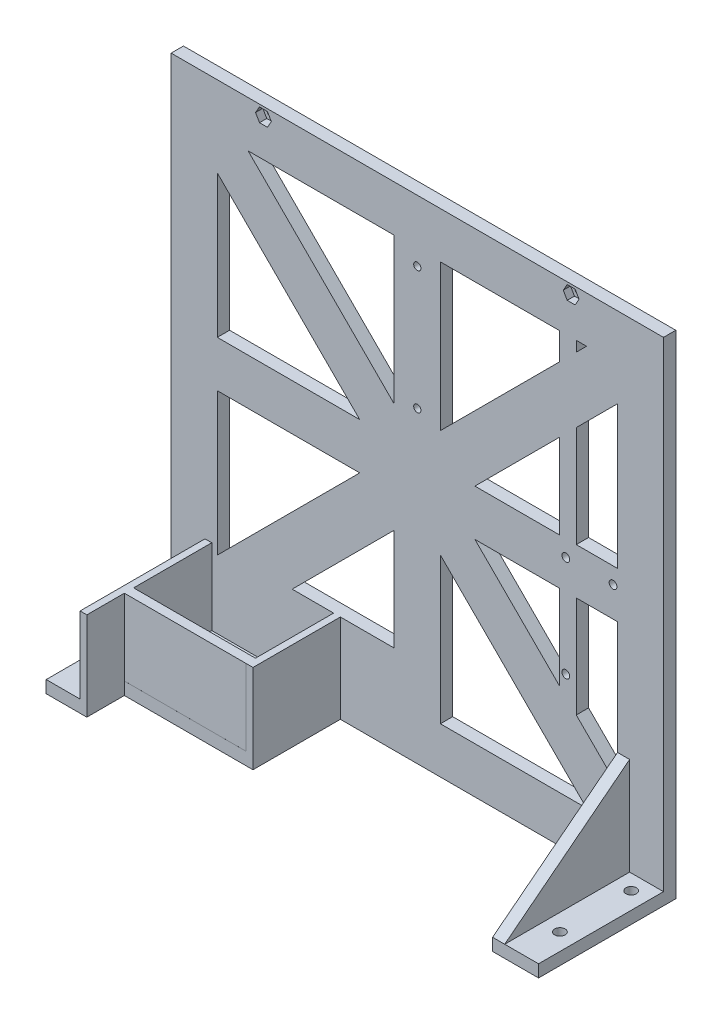
from build123d import *

# Parameters (mm, degrees)
SKETCH1_W           = 203.2
SKETCH1_H           = 203.2
SKETCH1_R           = 1.5
BOSS_EXTRUDE1_DEPTH = 5.08
SKETCH2_W           = 13.97
SKETCH2_H           = 5.08
BOSS_EXTRUDE2_DEPTH = 51.562
CUT_EXTRUDE1_REACH  = 231.744
SKETCH3_R           = 2.159
CUT_EXTRUDE4_DEPTH  = 3
BOSS_EXTRUDE3_REACH = 181.07
SKETCH12_W          = 3.81
SKETCH12_H          = 31.496
SKETCH14_W          = 15.49
SKETCH14_H          = 36.576
CUT_EXTRUDE5_DEPTH  = 53.086
SKETCH15_R          = 1.6
CUT_EXTRUDE6_DEPTH  = 10
CUT_EXTRUDE7_DEPTH  = 2.3
BOSS_EXTRUDE5_START = -13.97
SKETCH17_W          = 51.562
SKETCH17_H          = 5.08
BOSS_EXTRUDE5_DEPTH = 5


with BuildPart() as part:
    # Sketch1 → Boss-Extrude1 (new body)
    with BuildSketch(Plane.XY):
        Rectangle(SKETCH1_W, SKETCH1_H)
        Polygon((-82.55, -68.309231637), (-82.55, -9.525), (-23.765768363, -9.525), align=None, mode=Mode.SUBTRACT)
        Polygon((-51.657605136, -65.024), (-9.525, -22.891394864), (-9.525, -65.024), align=None, mode=Mode.SUBTRACT)
        Polygon((9.525, -82.55), (9.525, -22.225), (69.85, -82.55), align=None, mode=Mode.SUBTRACT)
        Polygon((82.55, -68.309231637), (65.605706321, -51.364937958), (65.605706321, -9.525), (82.55, -9.525), align=None, mode=Mode.SUBTRACT)
        Polygon((58.758115986, -44.517347622), (23.765768363, -9.525), (58.758115986, -9.525), align=None, mode=Mode.SUBTRACT)
        Polygon((-23.765768363, 9.525), (-82.55, 9.525), (-82.55, 68.309231637), align=None, mode=Mode.SUBTRACT)
        Polygon((-9.525, 22.225), (-69.85, 82.55), (-9.525, 82.55), align=None, mode=Mode.SUBTRACT)
        with Locations((-63.5, 97.79)):
            Circle(SKETCH1_R, mode=Mode.SUBTRACT)
        with Locations((0, 25.4)):
            Circle(SKETCH1_R, mode=Mode.SUBTRACT)
        Polygon((58.758115986, 44.517347622), (58.758115986, 9.525), (23.765768363, 9.525), align=None, mode=Mode.SUBTRACT)
        Polygon((9.525, 82.55), (58.758115986, 82.55), (58.758115986, 71.458115986), (9.525, 22.225), align=None, mode=Mode.SUBTRACT)
        Polygon((82.55, 9.525), (65.605706321, 9.525), (65.605706321, 51.364937958), (82.55, 68.309231637), align=None, mode=Mode.SUBTRACT)
        with Locations((0, 76.2)):
            Circle(SKETCH1_R, mode=Mode.SUBTRACT)
        Polygon((65.605706321, 78.305706321), (65.605706321, 82.55), (69.85, 82.55), align=None, mode=Mode.SUBTRACT)
        with Locations((63.5, 97.79)):
            Circle(SKETCH1_R, mode=Mode.SUBTRACT)
    extrude(amount=BOSS_EXTRUDE1_DEPTH)

    # Sketch2 → Boss-Extrude2 (add)
    with BuildSketch(Plane.XY.offset(5.08)):
        Polygon((-101.6, -96.52), (-101.6, -101.6), (-31.75, -101.6), (-31.75, -65.024), (-34.544, -65.024), (-34.544, -96.409365186), (-84.836, -96.409365186), (-84.836, -65.024), (-87.63, -65.024), (-87.63, -96.52), align=None)
        with Locations((94.615, -99.06)):
            Rectangle(SKETCH2_W, SKETCH2_H)
    extrude(amount=BOSS_EXTRUDE2_DEPTH)

    # Sketch3 → Cut-Extrude1 (cut, up to next)
    with BuildSketch(Plane(origin=(0, -96.52, 0), x_dir=(1, 0, 0), z_dir=(0, 1, 0)), mode=Mode.PRIVATE) as cut_extrude1_sk1:
        with Locations(Location((-94.615, -11.43, 0), (0, 0, 270))):
            Circle(SKETCH3_R)
    cut_extrude1_tool1 = extrude(cut_extrude1_sk1.sketch, amount=-CUT_EXTRUDE1_REACH, mode=Mode.PRIVATE) & part.part
    # Sketch3 → Cut-Extrude1 (cut, up to next)
    with BuildSketch(Plane(origin=(0, -96.52, 0), x_dir=(1, 0, 0), z_dir=(0, 1, 0)), mode=Mode.PRIVATE) as cut_extrude1_sk2:
        with Locations(Location((94.615, -11.43, 0), (0, 0, 270))):
            Circle(SKETCH3_R)
    cut_extrude1_tool2 = extrude(cut_extrude1_sk2.sketch, amount=-CUT_EXTRUDE1_REACH, mode=Mode.PRIVATE) & part.part
    # Sketch3 → Cut-Extrude1 (cut, up to next)
    with BuildSketch(Plane(origin=(0, -96.52, 0), x_dir=(1, 0, 0), z_dir=(0, 1, 0)), mode=Mode.PRIVATE) as cut_extrude1_sk3:
        with Locations(Location((94.615, -40.84, 0), (0, 0, 270))):
            Circle(SKETCH3_R)
    cut_extrude1_tool3 = extrude(cut_extrude1_sk3.sketch, amount=-CUT_EXTRUDE1_REACH, mode=Mode.PRIVATE) & part.part
    # Sketch3 → Cut-Extrude1 (cut, up to next)
    with BuildSketch(Plane(origin=(0, -96.52, 0), x_dir=(1, 0, 0), z_dir=(0, 1, 0)), mode=Mode.PRIVATE) as cut_extrude1_sk4:
        with Locations(Location((-94.615, -40.84, 0), (0, 0, 270))):
            Circle(SKETCH3_R)
    cut_extrude1_tool4 = extrude(cut_extrude1_sk4.sketch, amount=-CUT_EXTRUDE1_REACH, mode=Mode.PRIVATE) & part.part
    add(cut_extrude1_tool1.solids().sort_by_distance((-94.615, -96.52, 11.43))[0], mode=Mode.SUBTRACT)
    add(cut_extrude1_tool2.solids().sort_by_distance((94.615, -96.52, 11.43))[0], mode=Mode.SUBTRACT)
    add(cut_extrude1_tool3.solids().sort_by_distance((94.615, -96.52, 40.84))[0], mode=Mode.SUBTRACT)
    add(cut_extrude1_tool4.solids().sort_by_distance((-94.615, -96.52, 40.84))[0], mode=Mode.SUBTRACT)

    # Sketch11 → Cut-Extrude4 (cut)
    with BuildSketch(Plane.XY.offset(5.08)):
        Polygon((-61.86898549, 94.965), (-60.237970979, 97.79), (-61.86898549, 100.615), (-65.13101451, 100.615), (-66.762029021, 97.79), (-65.13101451, 94.965), align=None)
        Polygon((65.13101451, 94.965), (61.86898549, 94.965), (60.237970979, 97.79), (61.86898549, 100.615), (65.13101451, 100.615), (66.762029021, 97.79), align=None)
    extrude(amount=-CUT_EXTRUDE4_DEPTH, mode=Mode.SUBTRACT)

    # Sketch12 → Boss-Extrude3 (add, up to next)
    with BuildSketch(Plane.ZY.offset(34.544), mode=Mode.PRIVATE) as boss_extrude3_sk1:
        with Locations((39.243, -80.772)):
            Rectangle(SKETCH12_W, SKETCH12_H)
    boss_extrude3_tool1 = extrude(boss_extrude3_sk1.sketch, amount=BOSS_EXTRUDE3_REACH, mode=Mode.PRIVATE) - part.part
    add(boss_extrude3_tool1.solids().sort_by_distance((-34.544, -80.772, 39.243))[0])

    # Sketch14 → Cut-Extrude5 (cut)
    with BuildSketch(Plane(origin=(-31.75, 0, 0), x_dir=(0, 0, -1), z_dir=(1, 0, 0))):
        with Locations((-48.897, -83.312)):
            Rectangle(SKETCH14_W, SKETCH14_H)
    extrude(amount=-CUT_EXTRUDE5_DEPTH, mode=Mode.SUBTRACT)

    # Sketch15 → Cut-Extrude6 (cut)
    with BuildSketch(Plane.XY.offset(5.08)):
        with Locations((61.285165756, 2.786448521)):
            Circle(SKETCH15_R)
        with Locations((80.785165756, 2.786448521)):
            Circle(SKETCH15_R)
        with Locations((80.785165756, -38.937697653)):
            Circle(SKETCH15_R)
        with Locations((61.285165756, -38.937697653)):
            Circle(SKETCH15_R)
    extrude(amount=-CUT_EXTRUDE6_DEPTH, mode=Mode.SUBTRACT)

    # Sketch16 → Cut-Extrude7 (cut)
    with BuildSketch(Plane(origin=(0, 0, 0), x_dir=(-1, 0, 0), z_dir=(0, 0, -1))):
        Polygon((-1.58771324, 73.45), (1.58771324, 73.45), (3.175426481, 76.2), (1.58771324, 78.95), (-1.58771324, 78.95), (-3.175426481, 76.2), align=None)
        Polygon((-3.175426481, 25.4), (-1.58771324, 22.65), (1.58771324, 22.65), (3.175426481, 25.4), (1.58771324, 28.15), (-1.58771324, 28.15), align=None)
        Polygon((-64.460592236, 2.786448521), (-62.872878996, 0.036448521), (-59.697452515, 0.036448521), (-58.109739275, 2.786448521), (-59.697452515, 5.536448521), (-62.872878996, 5.536448521), align=None)
        Polygon((-83.960592236, 2.786448521), (-82.372878996, 0.036448521), (-79.197452515, 0.036448521), (-77.609739275, 2.786448521), (-79.197452515, 5.536448521), (-82.372878996, 5.536448521), align=None)
        Polygon((-64.460592236, -38.937697653), (-62.872878996, -41.687697653), (-59.697452515, -41.687697653), (-58.109739275, -38.937697653), (-59.697452515, -36.187697653), (-62.872878996, -36.187697653), align=None)
    extrude(amount=-CUT_EXTRUDE7_DEPTH, mode=Mode.SUBTRACT)

    # Sketch17 → Boss-Extrude5 (add)
    with BuildSketch(Plane(origin=(101.6, 0, 0), x_dir=(0, 0, -1), z_dir=(1, 0, 0)).offset(BOSS_EXTRUDE5_START)):
        Polygon((-5.08, -56.252401603), (-56.642, -96.52), (-5.08, -96.52), align=None)
        with Locations((-30.861, -99.06)):
            Rectangle(SKETCH17_W, SKETCH17_H)
    extrude(amount=-BOSS_EXTRUDE5_DEPTH)


solid = part.part
